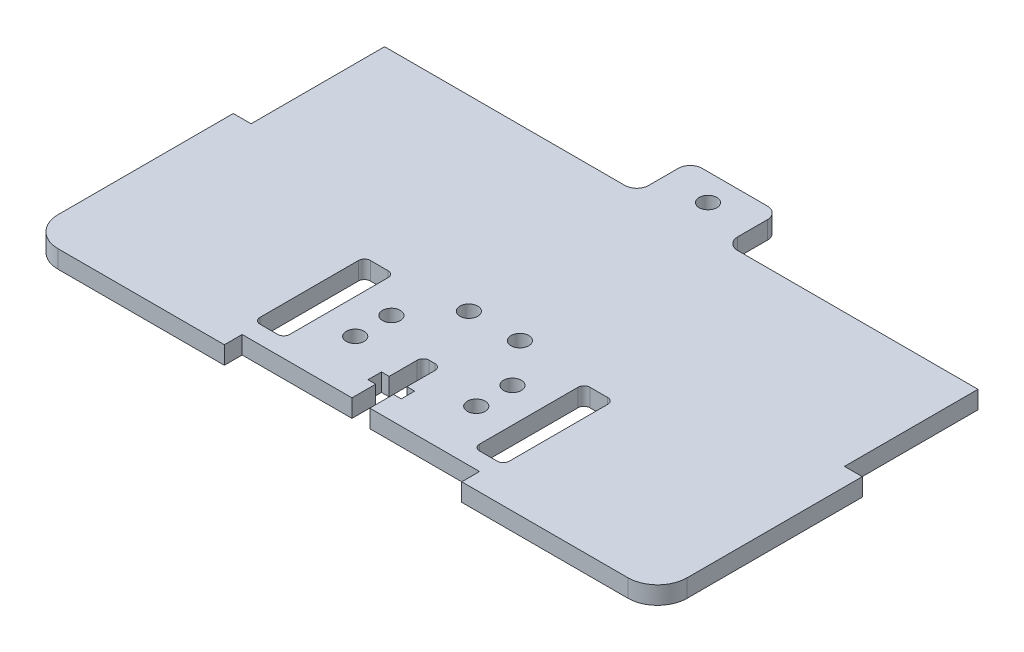
from build123d import *

# Parameters (mm, degrees)
SKETCH1_W                  = 106
SKETCH1_H                  = 57
BOSS_EXTRUDE1_DEPTH        = 1.5
CUT_EXTRUDE1_DEPTH         = 61.195514783
CUT_EXTRUDE1_DEPTH_BACK    = 61.195514783
SKETCH2_W                  = 3
SKETCH2_H                  = 22.5
SKETCH2_W_2                = 40
SKETCH2_H_2                = 3
SKETCH4_W                  = 15
SKETCH4_H                  = 9
BOSS_EXTRUDE2_DEPTH        = 1.5
FILLET1_R                  = 2
CUT_EXTRUDE2_DEPTH         = 65.942282066
CUT_EXTRUDE2_DEPTH_BACK    = 65.942282066
CUT_EXTRUDE3_DEPTH         = 65.942282066
CUT_EXTRUDE3_DEPTH_BACK    = 65.942282066
SKETCH5_R                  = 1.5
FILLET2_R                  = 5
CUT_EXTRUDE4_DEPTH         = 65.942282066
CUT_EXTRUDE4_DEPTH_BACK    = 65.942282066
SKETCH6_R                  = 1.5
CORTE_EXTRUS_O1_DEPTH      = 65.994230513
CORTE_EXTRUS_O1_DEPTH_BACK = 65.994230513


with BuildPart() as part:
    # Sketch1 → Boss-Extrude1 (new, symmetric)
    with BuildSketch(Plane(origin=(0, 0, 0), x_dir=(1, 0, 0), z_dir=(0, 1, 0))):
        Rectangle(SKETCH1_W, SKETCH1_H)
    extrude(amount=BOSS_EXTRUDE1_DEPTH, both=True)

    # Sketch2 → Cut-Extrude1 (cut, two sides: drawn at the far end of the back side and taken through both)
    with BuildSketch(Plane(origin=(0, 0, 0), x_dir=(1, 0, 0), z_dir=(0, 1, 0)).offset(-CUT_EXTRUDE1_DEPTH_BACK)):
        with Locations((-51.5, 17.25)):
            Rectangle(SKETCH2_W, SKETCH2_H)
        with Locations((51.5, 17.25)):
            Rectangle(SKETCH2_W, SKETCH2_H)
        with Locations((0, -27)):
            Rectangle(SKETCH2_W_2, SKETCH2_H_2)
    extrude(amount=CUT_EXTRUDE1_DEPTH + CUT_EXTRUDE1_DEPTH_BACK, mode=Mode.SUBTRACT)

    # Sketch4 → Boss-Extrude2 (add, symmetric)
    with BuildSketch(Plane(origin=(0, 0, 0), x_dir=(1, 0, 0), z_dir=(0, 1, 0))):
        with Locations((0, 33)):
            Rectangle(SKETCH4_W, SKETCH4_H)
    extrude(amount=BOSS_EXTRUDE2_DEPTH, both=True)

    # Fillet1
    fillet1_edges = [part.edges().sort_by_distance(p)[0] for p in [
        (-7.5, 0, -37.5),
        (-7.5, 0, -28.5),
        (7.5, 0, -28.5),
        (7.5, 0, -37.5),
    ]]
    fillet(fillet1_edges, radius=FILLET1_R)

    # Sketch3 → Cut-Extrude2 (cut, two sides: drawn at the far end of the back side and taken through both)
    with BuildSketch(Plane(origin=(0, 0, 0), x_dir=(1, 0, 0), z_dir=(0, 1, 0)).offset(-CUT_EXTRUDE2_DEPTH_BACK)):
        with BuildLine():
            Line((-1.5, -25.5), (1.5, -25.5))
            Line((1.5, -25.5), (1.5, -21.5))
            Line((1.5, -21.5), (2.8, -21.5))
            Line((2.8, -21.5), (2.8, -19.23))
            Line((2.8, -19.23), (1.5, -19.23))
            Line((1.5, -19.23), (1.5, -14.5))
            ThreePointArc((1.5, -14.5), (1.207106781, -13.792893219), (0.5, -13.5))
            Line((0.5, -13.5), (-0.5, -13.5))
            ThreePointArc((-0.5, -13.5), (-1.207106781, -13.792893219), (-1.5, -14.5))
            Line((-1.5, -14.5), (-1.5, -19.23))
            Line((-1.5, -19.23), (-2.8, -19.23))
            Line((-2.8, -19.23), (-2.8, -21.5))
            Line((-2.8, -21.5), (-1.5, -21.5))
            Line((-1.5, -21.5), (-1.5, -25.5))
        make_face()
    extrude(amount=CUT_EXTRUDE2_DEPTH + CUT_EXTRUDE2_DEPTH_BACK, mode=Mode.SUBTRACT)

    # Sketch5 → Cut-Extrude3 (cut, two sides: drawn at the far end of the back side and taken through both)
    with BuildSketch(Plane(origin=(0, 0, 0), x_dir=(1, 0, 0), z_dir=(0, 1, 0)).offset(-CUT_EXTRUDE3_DEPTH_BACK)):
        with Locations(Location((0, 33, 0), (0, 0, 270))):
            Circle(SKETCH5_R)
    extrude(amount=CUT_EXTRUDE3_DEPTH + CUT_EXTRUDE3_DEPTH_BACK, mode=Mode.SUBTRACT)

    # Fillet2
    fillet2_edges = [part.edges().sort_by_distance(p)[0] for p in [
        (53, 0, 28.5),
        (-53, 0, 28.5),
    ]]
    fillet(fillet2_edges, radius=FILLET2_R)

    # Sketch6 → Cut-Extrude4 (cut, two sides: drawn at the far end of the back side and taken through both)
    with BuildSketch(Plane(origin=(0, 0, 0), x_dir=(1, 0, 0), z_dir=(0, 1, 0)).offset(-CUT_EXTRUDE4_DEPTH_BACK)):
        with Locations(Location((-4.3, -3, 0), (0, 0, 270))):
            Circle(SKETCH6_R)
        with Locations(Location((4.3, -3, 0), (0, 0, 270))):
            Circle(SKETCH6_R)
        with Locations(Location((10.2, -10.15, 0), (0, 0, 270))):
            Circle(SKETCH6_R)
        with Locations(Location((10.2, -16.25, 0), (0, 0, 270))):
            Circle(SKETCH6_R)
        with Locations(Location((-10.2, -16.25, 0), (0, 0, 90))):
            Circle(SKETCH6_R)
        with Locations(Location((-10.2, -10.15, 0), (0, 0, 90))):
            Circle(SKETCH6_R)
    extrude(amount=CUT_EXTRUDE4_DEPTH + CUT_EXTRUDE4_DEPTH_BACK, mode=Mode.SUBTRACT)

    # Esboço1 → Corte-extrusão1 (cut, two sides: drawn at the far end of the back side and taken through both)
    with BuildSketch(Plane(origin=(0, 1.5, 0), x_dir=(1, 0, 0), z_dir=(0, 1, 0)).offset(-CORTE_EXTRUS_O1_DEPTH_BACK)):
        with BuildLine():
            Line((-20, -3.9), (-17, -3.9))
            ThreePointArc((-17, -3.9), (-16.292893219, -4.192893219), (-16, -4.9))
            Line((-16, -4.9), (-16, -21.5))
            ThreePointArc((-16, -21.5), (-16.292893219, -22.207106781), (-17, -22.5))
            Line((-17, -22.5), (-20, -22.5))
            ThreePointArc((-20, -22.5), (-20.707106781, -22.207106781), (-21, -21.5))
            Line((-21, -21.5), (-21, -4.9))
            ThreePointArc((-21, -4.9), (-20.707106781, -4.192893219), (-20, -3.9))
        make_face()
        with BuildLine():
            Line((21, -4.9), (21, -21.5))
            ThreePointArc((21, -21.5), (20.707106781, -22.207106781), (20, -22.5))
            Line((20, -22.5), (17, -22.5))
            ThreePointArc((17, -22.5), (16.292893219, -22.207106781), (16, -21.5))
            Line((16, -21.5), (16, -4.9))
            ThreePointArc((16, -4.9), (16.292893219, -4.192893219), (17, -3.9))
            Line((17, -3.9), (20, -3.9))
            ThreePointArc((20, -3.9), (20.707106781, -4.192893219), (21, -4.9))
        make_face()
    extrude(amount=CORTE_EXTRUS_O1_DEPTH + CORTE_EXTRUS_O1_DEPTH_BACK, mode=Mode.SUBTRACT)


solid = part.part
